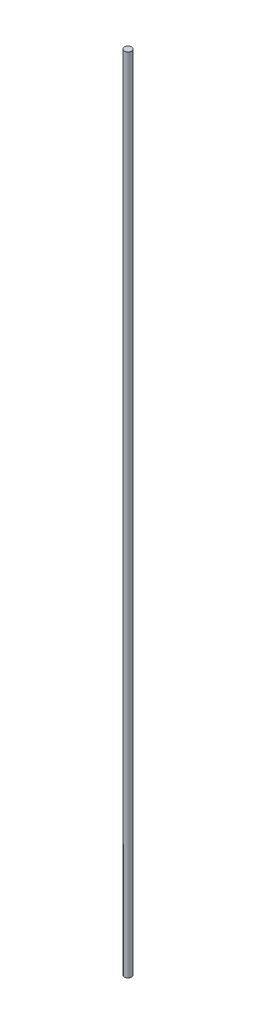
from build123d import *

# Parameters (mm, degrees)
SKETCH1_R           = 5
BOSS_EXTRUDE1_DEPTH = 1100


with BuildPart() as part:
    # Sketch1 → Boss-Extrude1 (new body)
    with BuildSketch(Plane(origin=(0, 0, 0), x_dir=(1, 0, 0), z_dir=(0, 1, 0))):
        with Locations(Location((0, 0, 0), (0, 0, 270))):
            Circle(SKETCH1_R)
    extrude(amount=BOSS_EXTRUDE1_DEPTH)


solid = part.part
